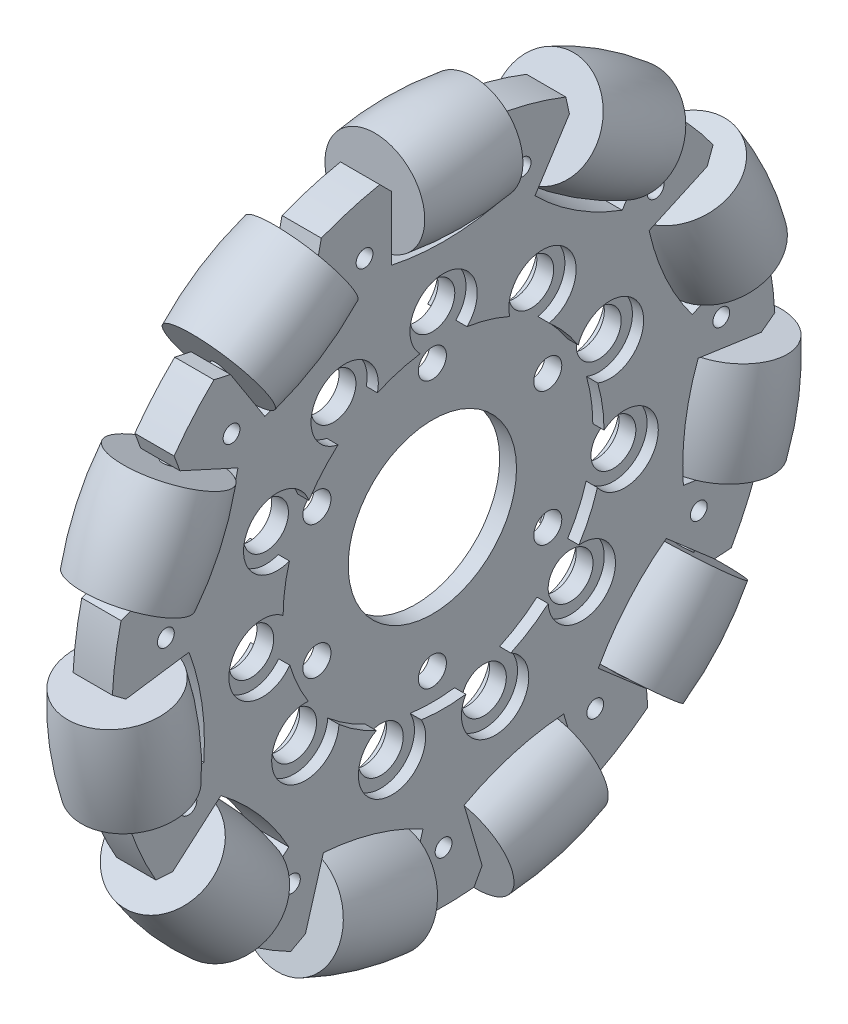
from build123d import *
from build123d.topology import SkipClean

# Parameters (mm, degrees)
SKETCH1_R           = 1.5
SKETCH1_R_2         = 4
SKETCH1_R_3         = 2.5
SKETCH1_R_4         = 15
BOSS_EXTRUDE1_DEPTH = 3
BOSS_EXTRUDE2_START = 2
SKETCH3_R           = 1.5
BOSS_EXTRUDE2_DEPTH = 2
LPATTERN1_COUNT     = 2
LPATTERN1_PITCH     = 5
CIRPATTERN1_COUNT   = 11


with BuildPart() as part:
    # Sketch1 → Boss-Extrude1 (new body)
    with BuildSketch(Plane(origin=(0, 0, 0), x_dir=(0, 0, -1), z_dir=(1, 0, 0))):
        with BuildLine():
            Line((-9.25, 44.5), (-9.25, 55.871632665))
            Line((-9.25, 55.871632665), (-11.373630353, 57.995263019))
            ThreePointArc((-11.373630353, 57.995263019), (-16.650394109, 56.706034741), (-21.786499691, 54.937768713))
            Line((-21.786499691, 54.937768713), (-22.424889978, 52.003135926))
            Line((-22.424889978, 52.003135926), (-16.276921198, 42.436709772))
            ThreePointArc((-16.276921198, 42.436709772), (-23.524033197, 36.604110149), (-31.840111555, 32.43485465))
            Line((-31.840111555, 32.43485465), (-37.988080335, 42.001280803))
            Line((-37.988080335, 42.001280803), (-40.922713123, 42.63967109))
            ThreePointArc((-40.922713123, 42.63967109), (-44.664799844, 38.702269376), (-48.02957002, 34.437921014))
            Line((-48.02957002, 34.437921014), (-46.980035835, 31.624010967))
            Line((-46.980035835, 31.624010967), (-36.636034923, 26.900064036))
            ThreePointArc((-36.636034923, 26.900064036), (-39.579352067, 18.075284442), (-44.321212664, 10.071872122))
            Line((-44.321212664, 10.071872122), (-54.665213575, 14.795819053))
            Line((-54.665213575, 14.795819053), (-57.479123622, 13.746284868))
            ThreePointArc((-57.479123622, 13.746284868), (-58.498447215, 8.410806942), (-59.023591228, 3.004276719))
            Line((-59.023591228, 3.004276719), (-56.619352259, 1.204485971))
            Line((-56.619352259, 1.204485971), (-45.363466418, 2.822838034))
            ThreePointArc((-45.363466418, 2.822838034), (-43.06850631, -6.192316362), (-42.73064191, -15.488858641))
            Line((-42.73064191, -15.488858641), (-53.986527751, -17.107210704))
            Line((-53.986527751, -17.107210704), (-55.786318499, -19.511449673))
            ThreePointArc((-55.786318499, -19.511449673), (-53.759250925, -24.551027268), (-51.278039262, -29.383204207))
            Line((-51.278039262, -29.383204207), (-48.282424394, -29.597454811))
            Line((-48.282424394, -29.597454811), (-39.688317848, -22.150619098))
            ThreePointArc((-39.688317848, -22.150619098), (-32.883714107, -28.493900474), (-27.57339427, -36.131986223))
            Line((-27.57339427, -36.131986223), (-36.167500816, -43.578821937))
            Line((-36.167500816, -43.578821937), (-36.38175142, -46.574436804))
            ThreePointArc((-36.38175142, -46.574436804), (-31.951872312, -49.71808379), (-27.252072143, -52.441725409))
            Line((-27.252072143, -52.441725409), (-24.616167932, -51.002412816))
            Line((-24.616167932, -51.002412816), (-21.412408785, -40.091411175))
            ThreePointArc((-21.412408785, -40.091411175), (-12.25857502, -41.748872514), (-3.661788774, -45.303463477))
            Line((-3.661788774, -45.303463477), (-6.86554792, -56.214465117))
            Line((-6.86554792, -56.214465117), (-5.426235326, -58.850369329))
            ThreePointArc((-5.426235326, -58.850369329), (0, -59.1), (5.426235326, -58.850369329))
            Line((5.426235326, -58.850369329), (6.86554792, -56.214465117))
            Line((6.86554792, -56.214465117), (3.661788774, -45.303463477))
            ThreePointArc((3.661788774, -45.303463477), (12.25857502, -41.748872514), (21.412408785, -40.091411175))
            Line((21.412408785, -40.091411175), (24.616167932, -51.002412816))
            Line((24.616167932, -51.002412816), (27.252072143, -52.441725409))
            ThreePointArc((27.252072143, -52.441725409), (31.951872312, -49.71808379), (36.38175142, -46.574436804))
            Line((36.38175142, -46.574436804), (36.167500816, -43.578821937))
            Line((36.167500816, -43.578821937), (27.57339427, -36.131986223))
            ThreePointArc((27.57339427, -36.131986223), (32.883714107, -28.493900474), (39.688317848, -22.150619098))
            Line((39.688317848, -22.150619098), (48.282424394, -29.597454811))
            Line((48.282424394, -29.597454811), (51.278039262, -29.383204207))
            ThreePointArc((51.278039262, -29.383204207), (53.759250925, -24.551027268), (55.786318499, -19.511449673))
            Line((55.786318499, -19.511449673), (53.986527751, -17.107210704))
            Line((53.986527751, -17.107210704), (42.73064191, -15.488858641))
            ThreePointArc((42.73064191, -15.488858641), (43.06850631, -6.192316362), (45.363466418, 2.822838034))
            Line((45.363466418, 2.822838034), (56.619352259, 1.204485971))
            Line((56.619352259, 1.204485971), (59.023591228, 3.004276719))
            ThreePointArc((59.023591228, 3.004276719), (58.498447215, 8.410806942), (57.479123622, 13.746284868))
            Line((57.479123622, 13.746284868), (54.665213575, 14.795819053))
            Line((54.665213575, 14.795819053), (44.321212664, 10.071872122))
            ThreePointArc((44.321212664, 10.071872122), (39.579352067, 18.075284442), (36.636034923, 26.900064036))
            Line((36.636034923, 26.900064036), (46.980035835, 31.624010967))
            Line((46.980035835, 31.624010967), (48.02957002, 34.437921014))
            ThreePointArc((48.02957002, 34.437921014), (44.664799844, 38.702269376), (40.922713123, 42.63967109))
            Line((40.922713123, 42.63967109), (37.988080335, 42.001280803))
            Line((37.988080335, 42.001280803), (31.840111555, 32.43485465))
            ThreePointArc((31.840111555, 32.43485465), (23.524033197, 36.604110149), (16.276921198, 42.436709772))
            Line((16.276921198, 42.436709772), (22.424889978, 52.003135926))
            Line((22.424889978, 52.003135926), (21.786499691, 54.937768713))
            ThreePointArc((21.786499691, 54.937768713), (16.650394109, 56.706034741), (11.373630353, 57.995263019))
            Line((11.373630353, 57.995263019), (9.25, 55.871632665))
            Line((9.25, 55.871632665), (9.25, 44.5))
            ThreePointArc((9.25, 44.5), (0, 43.511389517), (-9.25, 44.5))
        make_face()
        with Locations((-27.032040873, -42.062676642)):
            Circle(SKETCH1_R, mode=Mode.SUBTRACT)
        with Locations((-9.184481353, -31.27947094)):
            Circle(SKETCH1_R_2, mode=Mode.SUBTRACT)
        with Locations((-45.481599768, -20.77075065)):
            Circle(SKETCH1_R, mode=Mode.SUBTRACT)
        with Locations((-32.268179005, -4.639463728)):
            Circle(SKETCH1_R_2, mode=Mode.SUBTRACT)
        with Locations((-24.637436124, -21.348459927)):
            Circle(SKETCH1_R_2, mode=Mode.SUBTRACT)
        with Locations((-20.56810334, -11.875)):
            Circle(SKETCH1_R_3, mode=Mode.SUBTRACT)
        with Locations((0, -50)):
            Circle(SKETCH1_R, mode=Mode.SUBTRACT)
        with Locations((9.184481353, -31.27947094)):
            Circle(SKETCH1_R_2, mode=Mode.SUBTRACT)
        with Locations((27.032040873, -42.062676642)):
            Circle(SKETCH1_R, mode=Mode.SUBTRACT)
        with Locations((0, -23.75)):
            Circle(SKETCH1_R_3, mode=Mode.SUBTRACT)
        with Locations((24.637436124, -21.348459927)):
            Circle(SKETCH1_R_2, mode=Mode.SUBTRACT)
        with Locations((20.56810334, -11.875)):
            Circle(SKETCH1_R_3, mode=Mode.SUBTRACT)
        with Locations((45.481599768, -20.77075065)):
            Circle(SKETCH1_R, mode=Mode.SUBTRACT)
        with Locations((32.268179005, -4.639463728)):
            Circle(SKETCH1_R_2, mode=Mode.SUBTRACT)
        with Locations((-49.491072094, 7.115741914)):
            Circle(SKETCH1_R, mode=Mode.SUBTRACT)
        with Locations((-29.654003049, 13.542529424)):
            Circle(SKETCH1_R_2, mode=Mode.SUBTRACT)
        with Locations((-20.56810334, 11.875)):
            Circle(SKETCH1_R_3, mode=Mode.SUBTRACT)
        with Locations((-17.624890649, 27.42486517)):
            Circle(SKETCH1_R_2, mode=Mode.SUBTRACT)
        with Locations((-37.787478718, 32.743036697)):
            Circle(SKETCH1_R, mode=Mode.SUBTRACT)
        with Locations((-14.086627842, 47.974648681)):
            Circle(SKETCH1_R, mode=Mode.SUBTRACT)
        Circle(SKETCH1_R_4, mode=Mode.SUBTRACT)
        with Locations((20.56810334, 11.875)):
            Circle(SKETCH1_R_3, mode=Mode.SUBTRACT)
        with Locations((0, 23.75)):
            Circle(SKETCH1_R_3, mode=Mode.SUBTRACT)
        with Locations((17.624890649, 27.42486517)):
            Circle(SKETCH1_R_2, mode=Mode.SUBTRACT)
        with Locations((29.654003049, 13.542529424)):
            Circle(SKETCH1_R_2, mode=Mode.SUBTRACT)
        with Locations((49.491072094, 7.115741914)):
            Circle(SKETCH1_R, mode=Mode.SUBTRACT)
        with Locations((0, 32.6)):
            Circle(SKETCH1_R_2, mode=Mode.SUBTRACT)
        with Locations((14.086627842, 47.974648681)):
            Circle(SKETCH1_R, mode=Mode.SUBTRACT)
        with Locations((37.787478718, 32.743036697)):
            Circle(SKETCH1_R, mode=Mode.SUBTRACT)
    extrude(amount=BOSS_EXTRUDE1_DEPTH)

    # Sketch3 → Boss-Extrude2 (add)
    with SkipClean():  # the faces are left unmerged after this step: merging them gives an invalid solid
        with BuildSketch(Plane.ZY.offset(BOSS_EXTRUDE2_START)):
            with BuildLine():
                Line((9.25, 55.871632665), (9.25, 44.5))
                ThreePointArc((9.25, 44.5), (0, 43.511389517), (-9.25, 44.5))
                Line((-9.25, 44.5), (-9.25, 55.871632665))
                Line((-9.25, 55.871632665), (-11.373630353, 57.995263019))
                ThreePointArc((-11.373630353, 57.995263019), (-16.650394109, 56.706034741), (-21.786499691, 54.937768713))
                Line((-21.786499691, 54.937768713), (-22.424889978, 52.003135926))
                Line((-22.424889978, 52.003135926), (-16.276921198, 42.436709772))
                ThreePointArc((-16.276921198, 42.436709772), (-23.524033197, 36.604110149), (-31.840111555, 32.43485465))
                Line((-31.840111555, 32.43485465), (-37.988080335, 42.001280803))
                Line((-37.988080335, 42.001280803), (-40.922713123, 42.63967109))
                ThreePointArc((-40.922713123, 42.63967109), (-44.664799844, 38.702269376), (-48.02957002, 34.437921014))
                Line((-48.02957002, 34.437921014), (-46.980035835, 31.624010967))
                Line((-46.980035835, 31.624010967), (-36.636034923, 26.900064036))
                ThreePointArc((-36.636034923, 26.900064036), (-39.579352067, 18.075284442), (-44.321212664, 10.071872122))
                Line((-44.321212664, 10.071872122), (-54.665213575, 14.795819053))
                Line((-54.665213575, 14.795819053), (-57.479123622, 13.746284868))
                ThreePointArc((-57.479123622, 13.746284868), (-58.498447215, 8.410806942), (-59.023591228, 3.004276719))
                Line((-59.023591228, 3.004276719), (-56.619352259, 1.204485971))
                Line((-56.619352259, 1.204485971), (-45.363466418, 2.822838034))
                ThreePointArc((-45.363466418, 2.822838034), (-43.06850631, -6.192316362), (-42.73064191, -15.488858641))
                Line((-42.73064191, -15.488858641), (-53.986527751, -17.107210704))
                Line((-53.986527751, -17.107210704), (-55.786318499, -19.511449673))
                ThreePointArc((-55.786318499, -19.511449673), (-53.759250925, -24.551027268), (-51.278039262, -29.383204207))
                Line((-51.278039262, -29.383204207), (-48.282424394, -29.597454811))
                Line((-48.282424394, -29.597454811), (-39.688317848, -22.150619098))
                ThreePointArc((-39.688317848, -22.150619098), (-32.883714107, -28.493900474), (-27.57339427, -36.131986223))
                Line((-27.57339427, -36.131986223), (-36.167500816, -43.578821937))
                Line((-36.167500816, -43.578821937), (-36.38175142, -46.574436804))
                ThreePointArc((-36.38175142, -46.574436804), (-31.951872312, -49.71808379), (-27.252072143, -52.441725409))
                Line((-27.252072143, -52.441725409), (-24.616167932, -51.002412816))
                Line((-24.616167932, -51.002412816), (-21.412408785, -40.091411175))
                ThreePointArc((-21.412408785, -40.091411175), (-12.25857502, -41.748872514), (-3.661788774, -45.303463477))
                Line((-3.661788774, -45.303463477), (-6.86554792, -56.214465117))
                Line((-6.86554792, -56.214465117), (-5.426235326, -58.850369329))
                ThreePointArc((-5.426235326, -58.850369329), (0, -59.1), (5.426235326, -58.850369329))
                Line((5.426235326, -58.850369329), (6.86554792, -56.214465117))
                Line((6.86554792, -56.214465117), (3.661788774, -45.303463477))
                ThreePointArc((3.661788774, -45.303463477), (12.25857502, -41.748872514), (21.412408785, -40.091411175))
                Line((21.412408785, -40.091411175), (24.616167932, -51.002412816))
                Line((24.616167932, -51.002412816), (27.252072143, -52.441725409))
                ThreePointArc((27.252072143, -52.441725409), (31.951872312, -49.71808379), (36.38175142, -46.574436804))
                Line((36.38175142, -46.574436804), (36.167500816, -43.578821937))
                Line((36.167500816, -43.578821937), (27.57339427, -36.131986223))
                ThreePointArc((27.57339427, -36.131986223), (32.883714107, -28.493900474), (39.688317848, -22.150619098))
                Line((39.688317848, -22.150619098), (48.282424394, -29.597454811))
                Line((48.282424394, -29.597454811), (51.278039262, -29.383204207))
                ThreePointArc((51.278039262, -29.383204207), (53.759250925, -24.551027268), (55.786318499, -19.511449673))
                Line((55.786318499, -19.511449673), (53.986527751, -17.107210704))
                Line((53.986527751, -17.107210704), (42.73064191, -15.488858641))
                ThreePointArc((42.73064191, -15.488858641), (43.06850631, -6.192316362), (45.363466418, 2.822838034))
                Line((45.363466418, 2.822838034), (56.619352259, 1.204485971))
                Line((56.619352259, 1.204485971), (59.023591228, 3.004276719))
                ThreePointArc((59.023591228, 3.004276719), (58.498447215, 8.410806942), (57.479123622, 13.746284868))
                Line((57.479123622, 13.746284868), (54.665213575, 14.795819053))
                Line((54.665213575, 14.795819053), (44.321212664, 10.071872122))
                ThreePointArc((44.321212664, 10.071872122), (39.579352067, 18.075284442), (36.636034923, 26.900064036))
                Line((36.636034923, 26.900064036), (46.980035835, 31.624010967))
                Line((46.980035835, 31.624010967), (48.02957002, 34.437921014))
                ThreePointArc((48.02957002, 34.437921014), (44.664799844, 38.702269376), (40.922713123, 42.63967109))
                Line((40.922713123, 42.63967109), (37.988080335, 42.001280803))
                Line((37.988080335, 42.001280803), (31.840111555, 32.43485465))
                ThreePointArc((31.840111555, 32.43485465), (23.524033197, 36.604110149), (16.276921198, 42.436709772))
                Line((16.276921198, 42.436709772), (22.424889978, 52.003135926))
                Line((22.424889978, 52.003135926), (21.786499691, 54.937768713))
                ThreePointArc((21.786499691, 54.937768713), (16.650394109, 56.706034741), (11.373630353, 57.995263019))
                Line((11.373630353, 57.995263019), (9.25, 55.871632665))
            make_face()
            with Locations((-14.086627842, 47.974648681)):
                Circle(SKETCH3_R, mode=Mode.SUBTRACT)
            with Locations((14.086627842, 47.974648681)):
                Circle(SKETCH3_R, mode=Mode.SUBTRACT)
            with Locations((37.787478718, 32.743036697)):
                Circle(SKETCH3_R, mode=Mode.SUBTRACT)
            with Locations((49.491072094, 7.115741914)):
                Circle(SKETCH3_R, mode=Mode.SUBTRACT)
            with Locations((45.481599768, -20.77075065)):
                Circle(SKETCH3_R, mode=Mode.SUBTRACT)
            with Locations((27.032040873, -42.062676642)):
                Circle(SKETCH3_R, mode=Mode.SUBTRACT)
            with Locations((0, -50)):
                Circle(SKETCH3_R, mode=Mode.SUBTRACT)
            with Locations((-27.032040873, -42.062676642)):
                Circle(SKETCH3_R, mode=Mode.SUBTRACT)
            with Locations((-45.481599768, -20.77075065)):
                Circle(SKETCH3_R, mode=Mode.SUBTRACT)
            with Locations((-49.491072094, 7.115741914)):
                Circle(SKETCH3_R, mode=Mode.SUBTRACT)
            with Locations((-37.787478718, 32.743036697)):
                Circle(SKETCH3_R, mode=Mode.SUBTRACT)
            with BuildLine():
                ThreePointArc((-18.810864694, 21.543244172), (-21.614437827, 18.729016991), (-24.001030176, 15.553473904))
                ThreePointArc((-24.001030176, 15.553473904), (-35.111795021, 16.035019502), (-27.471863519, 7.953409003))
                ThreePointArc((-27.471863519, 7.953409003), (-28.308893238, 4.070204375), (-28.599794273, 0.108478296))
                ThreePointArc((-28.599794273, 0.108478296), (-38.207107657, -5.493352757), (-27.410739784, -8.161577328))
                ThreePointArc((-27.410739784, -8.161577328), (-26.015475067, -11.880869372), (-24.118325765, -15.370958405))
                ThreePointArc((-24.118325765, -15.370958405), (-29.17193357, -25.27762433), (-18.646899843, -21.685320525))
                ThreePointArc((-18.646899843, -21.685320525), (-15.462327379, -24.059851039), (-11.979459238, -25.970224419))
                ThreePointArc((-11.979459238, -25.970224419), (-10.874876694, -37.036428782), (-3.962800954, -28.324127676))
                ThreePointArc((-3.962800954, -28.324127676), (0, -28.6), (3.962800954, -28.324127676))
                ThreePointArc((3.962800954, -28.324127676), (10.874876694, -37.036428782), (11.979459238, -25.970224419))
                ThreePointArc((11.979459238, -25.970224419), (15.462327379, -24.059851039), (18.646899843, -21.685320525))
                ThreePointArc((18.646899843, -21.685320525), (29.17193357, -25.27762433), (24.118325765, -15.370958405))
                ThreePointArc((24.118325765, -15.370958405), (26.015475067, -11.880869372), (27.410739784, -8.161577328))
                ThreePointArc((27.410739784, -8.161577328), (38.207107657, -5.493352757), (28.599794273, 0.108478296))
                ThreePointArc((28.599794273, 0.108478296), (28.308893238, 4.070204375), (27.471863519, 7.953409003))
                ThreePointArc((27.471863519, 7.953409003), (35.111795021, 16.035019502), (24.001030176, 15.553473904))
                ThreePointArc((24.001030176, 15.553473904), (21.614437827, 18.729016991), (18.810864694, 21.543244172))
                ThreePointArc((18.810864694, 21.543244172), (20.868735554, 32.472386367), (11.782108581, 26.060351444))
                ThreePointArc((11.782108581, 26.060351444), (8.057551126, 27.441499045), (4.177549239, 28.293251534))
                ThreePointArc((4.177549239, 28.293251534), (0, 38.6), (-4.177549239, 28.293251534))
                ThreePointArc((-4.177549239, 28.293251534), (-8.057551126, 27.441499045), (-11.782108581, 26.060351444))
                ThreePointArc((-11.782108581, 26.060351444), (-20.868735554, 32.472386367), (-18.810864694, 21.543244172))
            make_face(mode=Mode.SUBTRACT)
        boss_extrude2 = extrude(amount=-BOSS_EXTRUDE2_DEPTH)

    # LPattern1: Boss-Extrude2 ×2
    with Locations(*[(i * LPATTERN1_PITCH, 0, 0) for i in range(1, LPATTERN1_COUNT)]):
        add(boss_extrude2)

    # Sketch5 → Revolve1 (revolve)
    with BuildSketch(Plane(origin=(1.5, 0, 0), x_dir=(0, 0, -1), z_dir=(1, 0, 0)), mode=Mode.PRIVATE) as revolve1_sk:
        with BuildLine():
            Line((-9.25, 55.25), (-9.25, 54))
            Line((-9.25, 54), (9.25, 54))
            Line((9.25, 54), (9.25, 55.25))
            Line((9.25, 55.25), (8.75, 55.25))
            Line((8.75, 55.25), (8.75, 62.894256495))
            ThreePointArc((8.75, 62.894256495), (0, 63.5), (-8.75, 62.894256495))
            Line((-8.75, 62.894256495), (-8.75, 55.25))
            Line((-8.75, 55.25), (-9.25, 55.25))
        make_face()
    revolve1 = revolve(revolve1_sk.sketch.rotate(Axis((1.5, 54, 9.25), (0, 0, -1)), 90), axis=Axis((1.5, 54, 9.25), (0, 0, -1)))

    # CirPattern1: Revolve1 ×11 about axis
    cirpattern1_axis = Axis((0, 0, 0), (1, 0, 0))
    for i in range(1, CIRPATTERN1_COUNT):
        add(revolve1.rotate(cirpattern1_axis, i * 360 / CIRPATTERN1_COUNT))


solid = part.part
